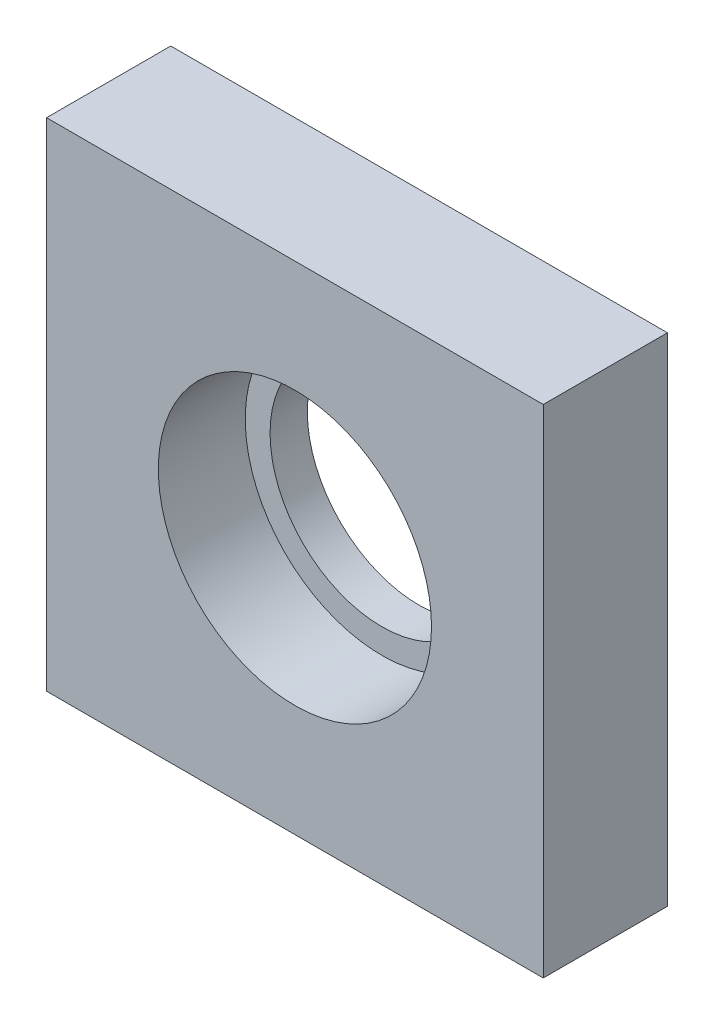
from build123d import *

# Parameters (mm, degrees)
BASE_EXTRUSION_DEPTH       = 10
ESQUISSE2_R                = 11
ENL_V_MAT_EXTRU_1_DEPTH    = 7
ESQUISSE3_R                = 9
ENL_V_MAT_EXTRU_2_DEPTH    = 44.588989435
ESQUISSE4_OUTSIDE_W        = 77.748
ESQUISSE4_OUTSIDE_H        = 67.748
ESQUISSE4_OUTSIDE_W_2      = 40
ESQUISSE4_OUTSIDE_H_2      = 40
ENL_V_MAT_EXTRU_3_DEPTH    = 44.588989435
R_P_TITION_LIN_AIRE1_COUNT = 2
R_P_TITION_LIN_AIRE1_PITCH = 30


with BuildPart() as part:
    # Esquisse1 → Base-Extrusion (new body)
    with BuildSketch(Plane.XY):
        with BuildLine():
            Line((-22.360679775, -20), (22.360679775, -20))
            ThreePointArc((22.360679775, -20), (0, 30), (-22.360679775, -20))
        make_face()
    extrude(amount=BASE_EXTRUSION_DEPTH)

    # Esquisse2 → Enlèv. mat.-Extru.1 (cut)
    with BuildSketch(Plane.XY.offset(10)):
        Circle(ESQUISSE2_R)
    extrude(amount=-ENL_V_MAT_EXTRU_1_DEPTH, mode=Mode.SUBTRACT)

    # Esquisse3 → Enlèv. mat.-Extru.2 (cut, through all)
    with BuildSketch(Plane(origin=(0, 0, 0), x_dir=(-1, 0, 0), z_dir=(0, 0, -1))):
        Circle(ESQUISSE3_R)
    extrude(amount=-ENL_V_MAT_EXTRU_2_DEPTH, mode=Mode.SUBTRACT)

    # Esquisse4 outside → Enlèv. mat.-Extru.3 (cut, through all)
    with BuildSketch(Plane.XY.offset(10)):
        with Locations((0, 5)):
            Rectangle(ESQUISSE4_OUTSIDE_W, ESQUISSE4_OUTSIDE_H)
        Rectangle(ESQUISSE4_OUTSIDE_W_2, ESQUISSE4_OUTSIDE_H_2, mode=Mode.SUBTRACT)
    extrude(amount=-ENL_V_MAT_EXTRU_3_DEPTH, mode=Mode.SUBTRACT)

    # Esquisse5 → Perçage1 (revolve, cut)
    with BuildSketch(Plane(origin=(15, -20, 5), x_dir=(0, 0, -1), z_dir=(1, 0, 0))):
        Polygon((0, 0), (0, 30.991420021), (1.65, 30), (1.65, 0), align=None)
    per_age1 = revolve(axis=Axis((15, -26.35, 5), (0, 1, 0)), mode=Mode.SUBTRACT)

    # Répétition linéaire1: Perçage1 ×2
    with Locations(*[(-i * R_P_TITION_LIN_AIRE1_PITCH, 0, 0) for i in range(1, R_P_TITION_LIN_AIRE1_COUNT)]):
        add(per_age1, mode=Mode.SUBTRACT)


solid = part.part
